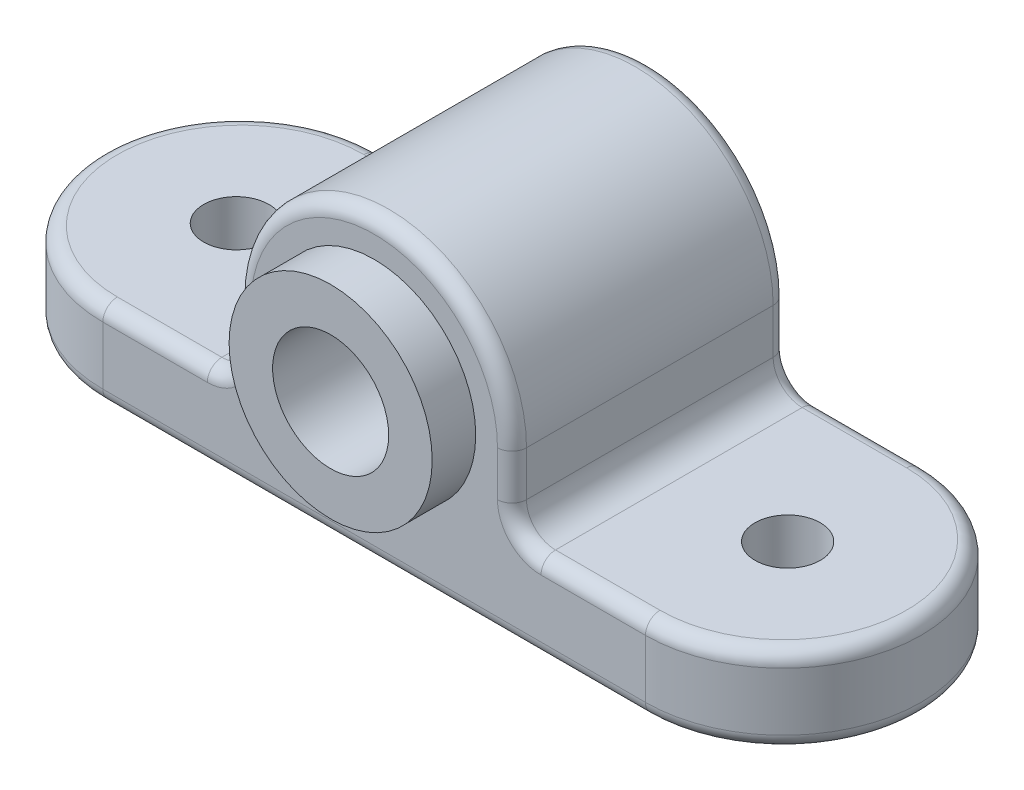
from build123d import *

# Parameters (mm, degrees)
SKETCH1_R           = 4
BOSS_EXTRUDE1_DEPTH = 19
SKETCH2_R           = 2.25
CUT_EXTRUDE2_DEPTH  = 19
SKETCH3_R           = 7
SKETCH3_R_2         = 4
BOSS_EXTRUDE2_DEPTH = 3
FILLET1_R           = 1


with BuildPart() as part:
    # Sketch1 → Boss-Extrude1 (new body)
    with BuildSketch(Plane.XY):
        with BuildLine():
            Line((-28.2, 0), (28.2, 0))
            Line((28.2, 0), (28.2, 6))
            Line((28.2, 6), (11.5, 6))
            ThreePointArc((11.5, 6), (10.085786438, 6.585786438), (9.5, 8))
            Line((9.5, 8), (9.5, 11.1))
            ThreePointArc((9.5, 11.1), (0, 20.6), (-9.5, 11.1))
            Line((-9.5, 11.1), (-9.5, 8))
            ThreePointArc((-9.5, 8), (-10.085786438, 6.585786438), (-11.5, 6))
            Line((-11.5, 6), (-28.2, 6))
            Line((-28.2, 6), (-28.2, 0))
        make_face()
        with Locations((0, 11.1)):
            Circle(SKETCH1_R, mode=Mode.SUBTRACT)
    extrude(amount=BOSS_EXTRUDE1_DEPTH)

    # Sketch2 → Cut-Extrude2 (cut)
    with BuildSketch(Plane.XZ):
        with BuildLine():
            Line((28.2, 19), (18.7, 19))
            ThreePointArc((18.7, 19), (25.417514421, 16.217514421), (28.2, 9.5))
            Line((28.2, 9.5), (28.2, 19))
        make_face()
        with BuildLine():
            ThreePointArc((-28.2, 9.5), (-25.417514421, 16.217514421), (-18.7, 19))
            Line((-18.7, 19), (-28.2, 19))
            Line((-28.2, 19), (-28.2, 9.5))
        make_face()
        with BuildLine():
            Line((28.2, 0), (28.2, 9.5))
            ThreePointArc((28.2, 9.5), (25.417514421, 2.782485579), (18.7, 0))
            Line((18.7, 0), (28.2, 0))
        make_face()
        with BuildLine():
            ThreePointArc((-18.7, 0), (-25.417514421, 2.782485579), (-28.2, 9.5))
            Line((-28.2, 9.5), (-28.2, 0))
            Line((-28.2, 0), (-18.7, 0))
        make_face()
        with Locations(Location((19, 9.5, 0), (0, 0, 270))):
            Circle(SKETCH2_R)
        with Locations(Location((-19, 9.5, 0), (0, 0, 270))):
            Circle(SKETCH2_R)
    extrude(amount=-CUT_EXTRUDE2_DEPTH, mode=Mode.SUBTRACT)

    # Sketch3 → Boss-Extrude2 (add)
    with BuildSketch(Plane.XY.offset(19)):
        with Locations((0, 11.1)):
            Circle(SKETCH3_R)
        with Locations((0, 11.1)):
            Circle(SKETCH3_R_2, mode=Mode.SUBTRACT)
    extrude(amount=BOSS_EXTRUDE2_DEPTH)

    # Fillet1
    fillet1_edges = [part.edges().sort_by_distance(p)[0] for p in [
        (10.085786438, 6.585786438, 19),
        (-15.1, 6, 0),
        (-10.085786438, 6.585786438, 0),
        (-9.5, 9.55, 0),
        (0, 20.6, 0),
        (9.5, 9.55, 0),
        (10.085786438, 6.585786438, 0),
        (9.5, 9.55, 19),
        (0, 20.6, 19),
        (-9.5, 9.55, 19),
        (-10.085786438, 6.585786438, 19),
        (-15.1, 6, 19),
        (0, 0, 19),
        (-28.2, 6, 9.5),
        (-28.2, 0, 9.5),
        (0, 0, 0),
        (15.1, 6, 19),
        (28.2, 0, 9.5),
        (28.2, 6, 9.5),
        (15.1, 6, 0),
    ]]
    fillet(fillet1_edges, radius=FILLET1_R)


solid = part.part
